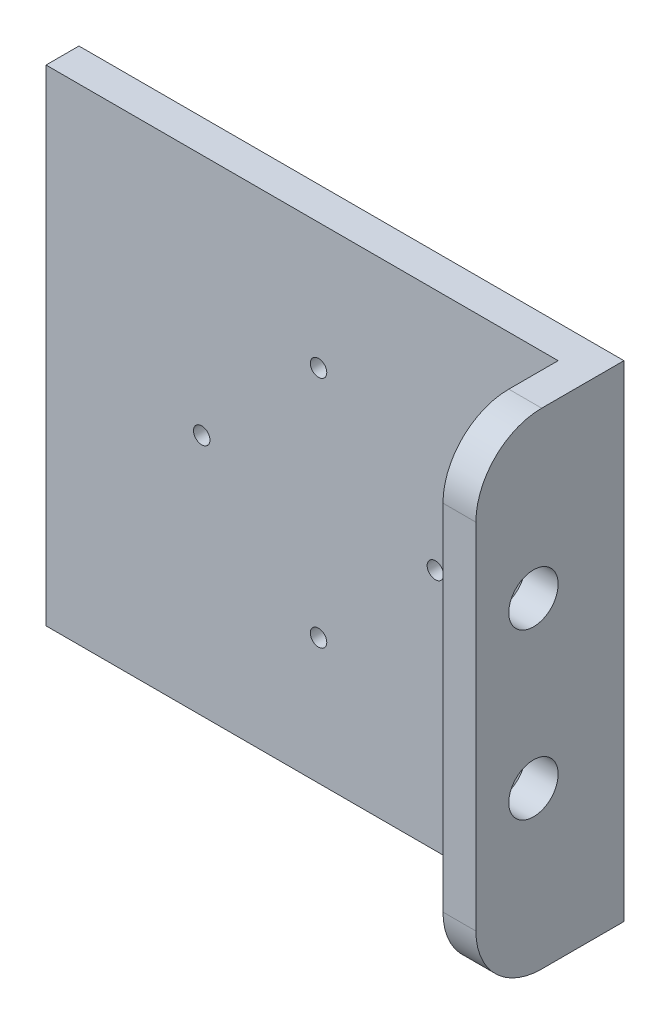
from build123d import *

# Parameters (mm, degrees)
SKETCH_1_W          = 33.124171168
SKETCH_1_H          = 29.521848668
SKETCH_1_R          = 0.5
EXTRUDE_1_DEPTH     = 2
EXTRUDE_2_DEPTH     = 2
CUT_EXTRUDE_1_DEPTH = 6


with BuildPart() as part:
    # 草图1 → 凸台-拉伸1 (new body)
    with BuildSketch(Plane.XY):
        Rectangle(SKETCH_1_W, SKETCH_1_H)
        with Locations((0, 7.1)):
            Circle(SKETCH_1_R, mode=Mode.SUBTRACT)
        with Locations((7.1, 0)):
            Circle(SKETCH_1_R, mode=Mode.SUBTRACT)
        with Locations((0, -7.1)):
            Circle(SKETCH_1_R, mode=Mode.SUBTRACT)
        with Locations((-7.1, 0)):
            Circle(SKETCH_1_R, mode=Mode.SUBTRACT)
    extrude(amount=EXTRUDE_1_DEPTH)

    # 草图2 → 凸台-拉伸2 (add)
    with BuildSketch(Plane(origin=(16.562085584, 0, 0), x_dir=(0, 0, -1), z_dir=(1, 0, 0))):
        with BuildLine():
            Line((-5, -14.760924334), (0, -14.760924334))
            Line((0, -14.760924334), (0, 14.760924334))
            Line((0, 14.760924334), (-5, 14.760924334))
            ThreePointArc((-5, 14.760924334), (-7.828427125, 13.589351458), (-9, 10.760924334))
            Line((-9, 10.760924334), (-9, -10.760924334))
            ThreePointArc((-9, -10.760924334), (-7.828427125, -13.589351458), (-5, -14.760924334))
        make_face()
    extrude(amount=-EXTRUDE_2_DEPTH)

    # 草图3 → 切除-拉伸1 (cut)
    with BuildSketch(Plane(origin=(16.562085584, 0, 0), x_dir=(0, 0, -1), z_dir=(1, 0, 0))):
        with BuildLine():
            ThreePointArc((-7, -5), (-5.5, -6.5), (-4, -5))
            ThreePointArc((-4, -5), (-5.5, -3.5), (-7, -5))
        make_face()
        with BuildLine():
            ThreePointArc((-7, 5), (-5.5, 3.5), (-4, 5))
            ThreePointArc((-4, 5), (-5.5, 6.5), (-7, 5))
        make_face()
    extrude(amount=-CUT_EXTRUDE_1_DEPTH, mode=Mode.SUBTRACT)


solid = part.part
